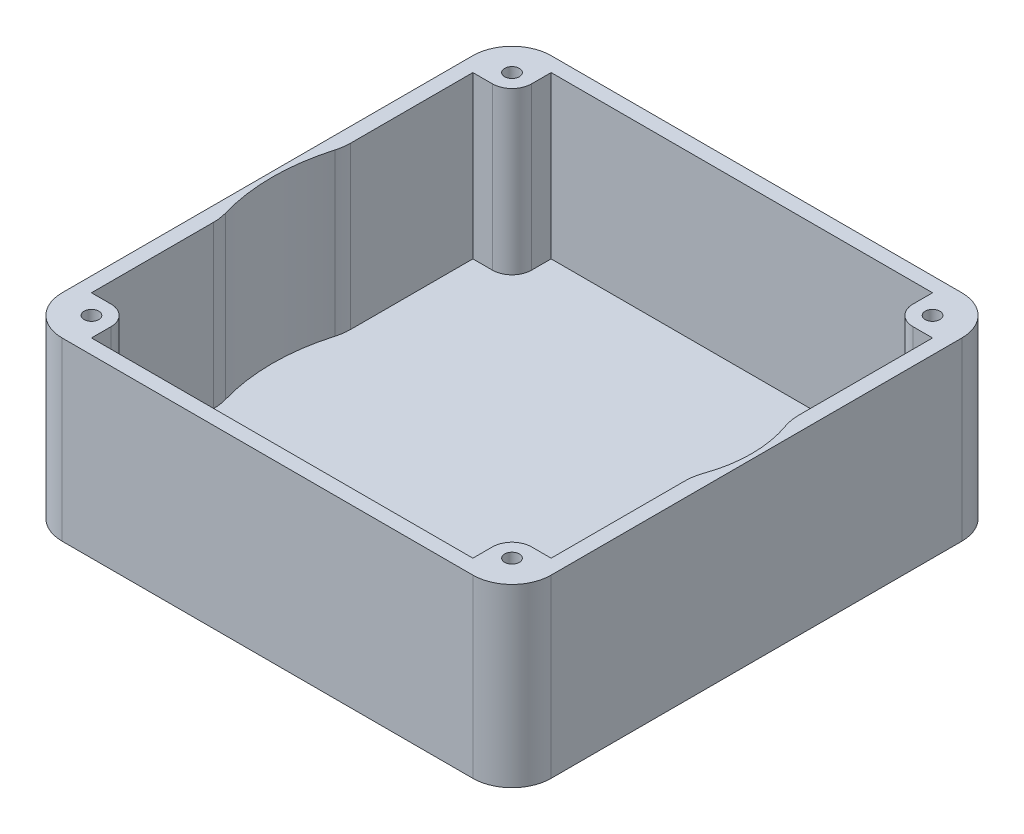
from build123d import *

# Parameters (mm, degrees)
SKETCH_1_W      = 100
SKETCH_1_H      = 100
EXTRUDE_1_DEPTH = 3
SKETCH_4_W      = 100
SKETCH_4_H      = 100
EXTRUDE_4_DEPTH = 33
FILLET_3_R      = 8
SKETCH_7_R      = 1.5
EXTRUDE_6_DEPTH = 33


with BuildPart() as part:
    # Эскиз1 → Бобышка-Вытянуть1 (new body)
    with BuildSketch(Plane(origin=(0, 0, 0), x_dir=(1, 0, 0), z_dir=(0, 1, 0))):
        with Locations((50, 50)):
            Rectangle(SKETCH_1_W, SKETCH_1_H)
    extrude(amount=EXTRUDE_1_DEPTH)

    # Эскиз4 → Бобышка-Вытянуть4 (add)
    with BuildSketch(Plane(origin=(0, 3, 0), x_dir=(1, 0, 0), z_dir=(0, 1, 0))):
        with Locations((50, 50)):
            Rectangle(SKETCH_4_W, SKETCH_4_H)
        with BuildLine():
            Line((97, 97), (3, 97))
            Line((3, 97), (3, 64))
            ThreePointArc((3, 64), (2.899494937, 62.585786438), (2.6, 61.2))
            ThreePointArc((2.6, 61.2), (1, 50), (2.6, 38.8))
            ThreePointArc((2.6, 38.8), (2.899494937, 37.414213562), (3, 36))
            Line((3, 36), (3, 3))
            Line((3, 3), (97, 3))
            Line((97, 3), (97, 38.33809621))
            ThreePointArc((97, 38.33809621), (97.143892394, 40.02840472), (97.571428571, 41.670068722))
            ThreePointArc((97.571428571, 41.670068722), (99, 50), (97.571428571, 58.329931278))
            ThreePointArc((97.571428571, 58.329931278), (97.143892394, 59.97159528), (97, 61.66190379))
            Line((97, 61.66190379), (97, 97))
        make_face(mode=Mode.SUBTRACT)
    extrude(amount=EXTRUDE_4_DEPTH)

    # Скругление3
    fillet_3_edges = [part.edges().sort_by_distance(p)[0] for p in [
        (0, 18, -100),
        (100, 18, -100),
        (100, 18, 0),
        (0, 18, 0),
    ]]
    fillet(fillet_3_edges, radius=FILLET_3_R)

    # Эскиз7 → Бобышка-Вытянуть6 (add)
    # profile 1 of 4: a face of its own
    with BuildSketch(Plane(origin=(0, 3, 0), x_dir=(1, 0, 0), z_dir=(0, 1, 0))):
        with BuildLine():
            Line((3, 89), (3, 97))
            Line((3, 97), (11, 97))
            Line((11, 97), (11, 93))
            ThreePointArc((11, 93), (9.828427125, 90.171572875), (7, 89))
            Line((7, 89), (3, 89))
        make_face()
        with Locations(Location((7, 93, 0), (0, 0, 270))):
            Circle(SKETCH_7_R, mode=Mode.SUBTRACT)
    # profile 2 of 4: a face of its own
    with BuildSketch(Plane(origin=(0, 3, 0), x_dir=(1, 0, 0), z_dir=(0, 1, 0))):
        with BuildLine():
            Line((89, 93), (89, 97))
            Line((89, 97), (97, 97))
            Line((97, 97), (97, 89))
            Line((97, 89), (93, 89))
            ThreePointArc((93, 89), (90.171572875, 90.171572875), (89, 93))
        make_face()
        with Locations(Location((93, 93, 0), (0, 0, 90))):
            Circle(SKETCH_7_R, mode=Mode.SUBTRACT)
    # profile 3 of 4: a face of its own
    with BuildSketch(Plane(origin=(0, 3, 0), x_dir=(1, 0, 0), z_dir=(0, 1, 0))):
        with BuildLine():
            Line((97, 11), (97, 3))
            Line((97, 3), (89, 3))
            Line((89, 3), (89, 7))
            ThreePointArc((89, 7), (90.171572875, 9.828427125), (93, 11))
            Line((93, 11), (97, 11))
        make_face()
        with Locations(Location((93, 7, 0), (0, 0, 270))):
            Circle(SKETCH_7_R, mode=Mode.SUBTRACT)
    # profile 4 of 4: a face of its own
    with BuildSketch(Plane(origin=(0, 3, 0), x_dir=(1, 0, 0), z_dir=(0, 1, 0))):
        with BuildLine():
            Line((11, 7), (11, 3))
            Line((11, 3), (3, 3))
            Line((3, 3), (3, 11))
            Line((3, 11), (7, 11))
            ThreePointArc((7, 11), (9.828427125, 9.828427125), (11, 7))
        make_face()
        with Locations(Location((7, 7, 0), (0, 0, 90))):
            Circle(SKETCH_7_R, mode=Mode.SUBTRACT)
    extrude(amount=EXTRUDE_6_DEPTH)


solid = part.part
